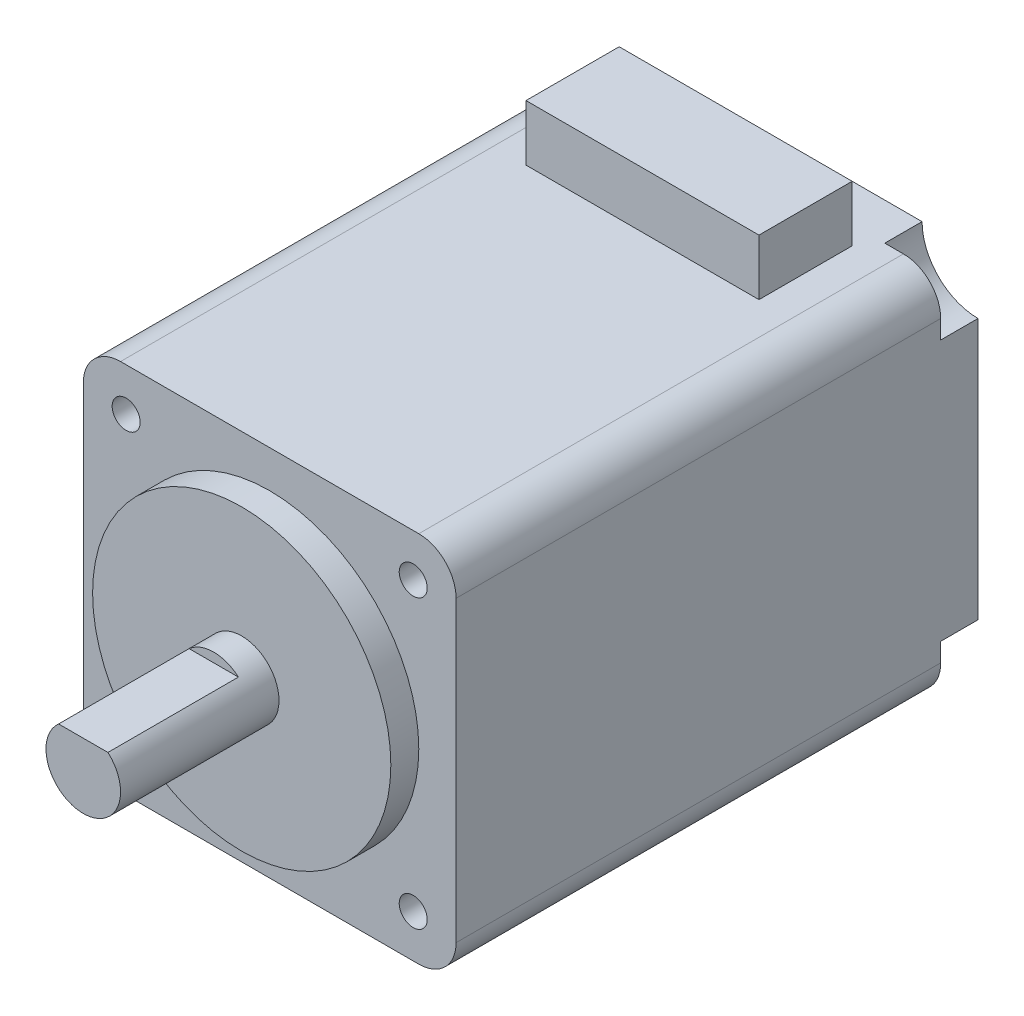
from build123d import *

# Parameters (mm, degrees)
ESBO_O1_W                = 20
ESBO_O1_H                = 20
RESSALTO_EXTRUS_O1_DEPTH = 28
ESBO_O2_R                = 3.25
ESBO_O2_R_2              = 3
CORTE_EXTRUS_O1_DEPTH    = 2
ESBO_O3_W                = 12.5
ESBO_O3_H                = 5
RESSALTO_EXTRUS_O2_DEPTH = 3
FILETE1_R                = 2
ESBO_O4_R                = 8
RESSALTO_EXTRUS_O3_DEPTH = 1.5
ESBO_O5_R                = 2
RESSALTO_EXTRUS_O4_DEPTH = 8.5
ESBO_O6_W                = 5.42124419
ESBO_O6_H                = 2.409441862
CORTE_EXTRUS_O2_DEPTH    = 7
ESBO_O7_R                = 0.75
CORTE_EXTRUS_O3_DEPTH    = 5


with BuildPart() as part:
    # Esboço1 → Ressalto-extrusão1 (new body)
    with BuildSketch(Plane.XY):
        Rectangle(ESBO_O1_W, ESBO_O1_H)
    extrude(amount=RESSALTO_EXTRUS_O1_DEPTH)

    # Esboço2 → Corte-extrusão1 (cut)
    with BuildSketch(Plane(origin=(0, 0, 0), x_dir=(-1, 0, 0), z_dir=(0, 0, -1))):
        Circle(ESBO_O2_R)
        with Locations((-10, 10)):
            Circle(ESBO_O2_R_2)
        with Locations((10, 10)):
            Circle(ESBO_O2_R_2)
        with Locations((10, -10)):
            Circle(ESBO_O2_R_2)
        with Locations((-10, -10)):
            Circle(ESBO_O2_R_2)
    extrude(amount=-CORTE_EXTRUS_O1_DEPTH, mode=Mode.SUBTRACT)

    # Esboço3 → Ressalto-extrusão2 (add)
    with BuildSketch(Plane(origin=(0, 10, 0), x_dir=(1, 0, 0), z_dir=(0, 1, 0))):
        with Locations((0, -5.5)):
            Rectangle(ESBO_O3_W, ESBO_O3_H)
    extrude(amount=RESSALTO_EXTRUS_O2_DEPTH)

    # Filete1
    filete1_edges = [part.edges().sort_by_distance(p)[0] for p in [
        (10, -10, 15),
        (-10, -10, 15),
        (-10, 10, 15),
        (10, 10, 15),
    ]]
    fillet(filete1_edges, radius=FILETE1_R)

    # Esboço4 → Ressalto-extrusão3 (add)
    with BuildSketch(Plane.XY.offset(28)):
        Circle(ESBO_O4_R)
    extrude(amount=RESSALTO_EXTRUS_O3_DEPTH)

    # Esboço5 → Ressalto-extrusão4 (add)
    with BuildSketch(Plane.XY.offset(29.5)):
        Circle(ESBO_O5_R)
    extrude(amount=RESSALTO_EXTRUS_O4_DEPTH)

    # Esboço6 → Corte-extrusão2 (cut)
    with BuildSketch(Plane.XY.offset(38)):
        with Locations((0, 2.704720931)):
            Rectangle(ESBO_O6_W, ESBO_O6_H)
    extrude(amount=-CORTE_EXTRUS_O2_DEPTH, mode=Mode.SUBTRACT)

    # Esboço7 → Corte-extrusão3 (cut)
    with BuildSketch(Plane.XY.offset(28)):
        with Locations((-7.7, 7.7)):
            Circle(ESBO_O7_R)
        with Locations((7.7, 7.7)):
            Circle(ESBO_O7_R)
        with Locations((7.7, -7.7)):
            Circle(ESBO_O7_R)
        with Locations((-7.7, -7.7)):
            Circle(ESBO_O7_R)
    extrude(amount=-CORTE_EXTRUS_O3_DEPTH, mode=Mode.SUBTRACT)


solid = part.part
